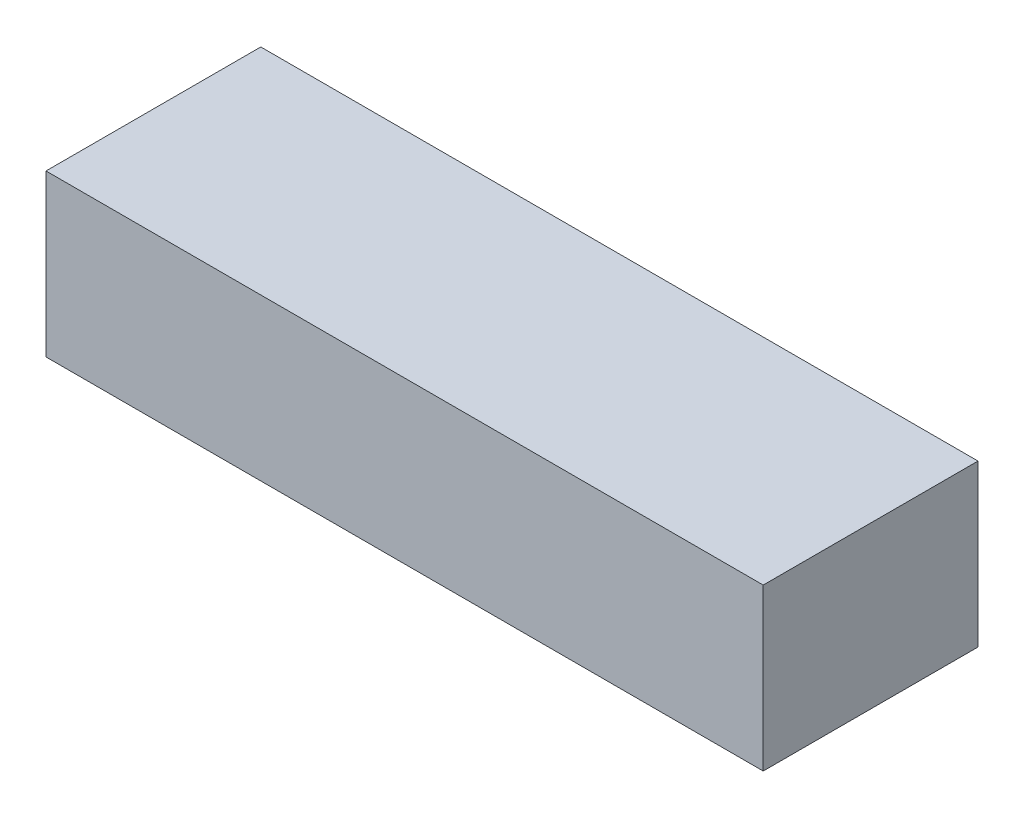
from build123d import *

# Parameters (mm, degrees)
SKETCH1_W           = 935
SKETCH1_H           = 280
BOSS_EXTRUDE1_DEPTH = 210


with BuildPart() as part:
    # Sketch1 → Boss-Extrude1 (new body)
    with BuildSketch(Plane(origin=(0, 0, 0), x_dir=(1, 0, 0), z_dir=(0, 1, 0))):
        with Locations((0, 140)):
            Rectangle(SKETCH1_W, SKETCH1_H)
    extrude(amount=-BOSS_EXTRUDE1_DEPTH)


solid = part.part
